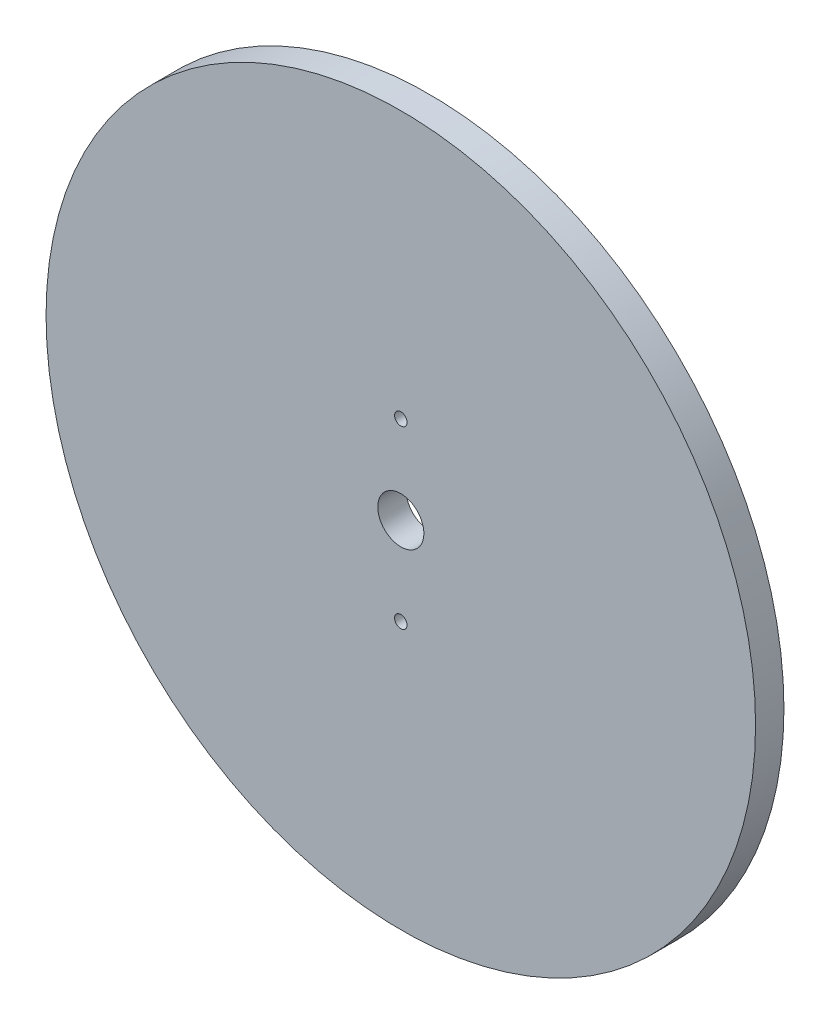
from build123d import *

# Parameters (mm, degrees)
SKETCH1_R           = 100
BOSS_EXTRUDE1_DEPTH = 8
SKETCH2_R           = 1.75
SKETCH2_R_2         = 6.5
CUT_EXTRUDE2_DEPTH  = 9


with BuildPart() as part:
    # Sketch1 → Boss-Extrude1 (new body)
    with BuildSketch(Plane.XY):
        Circle(SKETCH1_R)
    extrude(amount=BOSS_EXTRUDE1_DEPTH)

    # Sketch2 → Cut-Extrude2 (cut)
    with BuildSketch(Plane.XY):
        with Locations((0, 24.75)):
            Circle(SKETCH2_R)
        with Locations((0, -24.75)):
            Circle(SKETCH2_R)
        Circle(SKETCH2_R_2)
    extrude(amount=CUT_EXTRUDE2_DEPTH, mode=Mode.SUBTRACT)


solid = part.part
